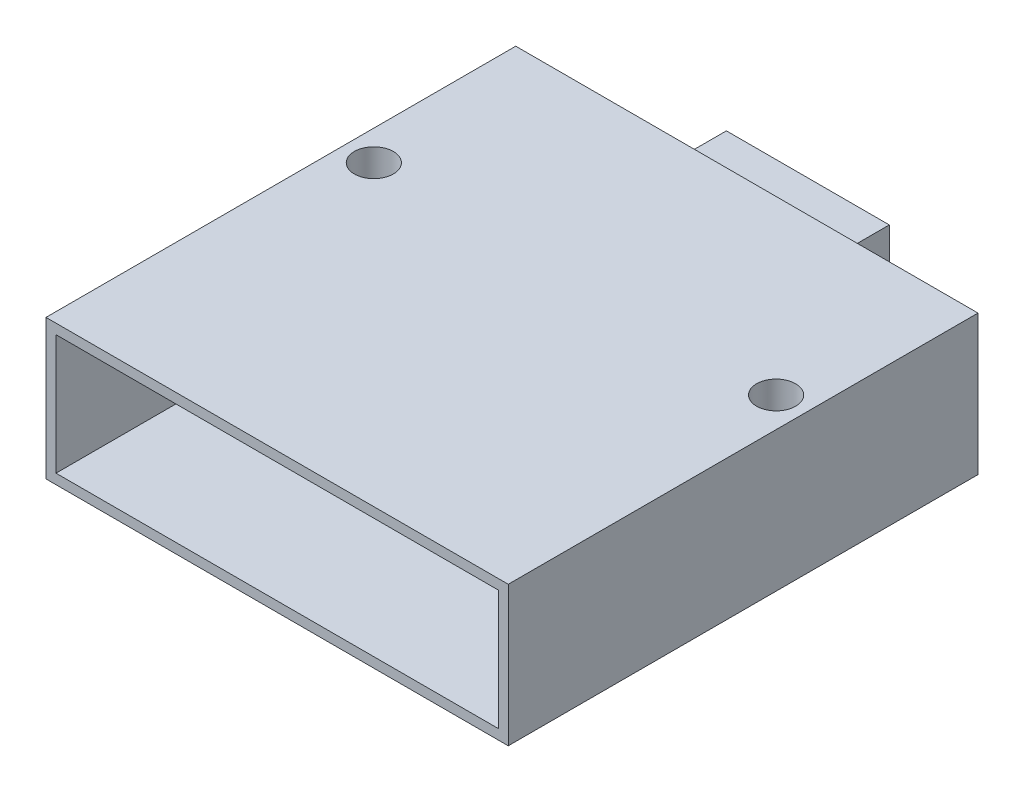
from build123d import *

# Parameters (mm, degrees)
SKETCH1_W                        = 117.475
SKETCH1_H                        = 35.56
EXTRUDE1_DEPTH                   = 119.38
SKETCH2_W                        = 41.402
SKETCH2_H                        = 20.828
EXTRUDE2_DEPTH                   = 15.494
F_25_64_0_39063_DIAMETER_HOLE1_D = 9.922002
SHELL1_T                         = -2.54


with BuildPart() as part:
    # Sketch1 → Extrude1 (new body)
    with BuildSketch(Plane.XY):
        Rectangle(SKETCH1_W, SKETCH1_H)
    extrude(amount=EXTRUDE1_DEPTH)

    # Sketch2 → Extrude2 (add)
    with BuildSketch(Plane(origin=(0, 0, 0), x_dir=(-1, 0, 0), z_dir=(0, 0, -1))):
        Rectangle(SKETCH2_W, SKETCH2_H)
    extrude(amount=EXTRUDE2_DEPTH)

    # 25/64 (0.39063) Diameter Hole1 (through all)
    with Locations(Plane(origin=(-51.1175, -17.78, 43.688), x_dir=(0, 0, -1), z_dir=(0, -1, 0))):
        with Locations((0, 0), (0, 102.235)):
            Hole(F_25_64_0_39063_DIAMETER_HOLE1_D / 2)

    # Shell1
    shell1_openings = [part.faces().sort_by_distance(p)[0] for p in [
        (0, 0, 119.38),
    ]]
    offset(amount=SHELL1_T, openings=shell1_openings, kind=Kind.INTERSECTION)


solid = part.part
